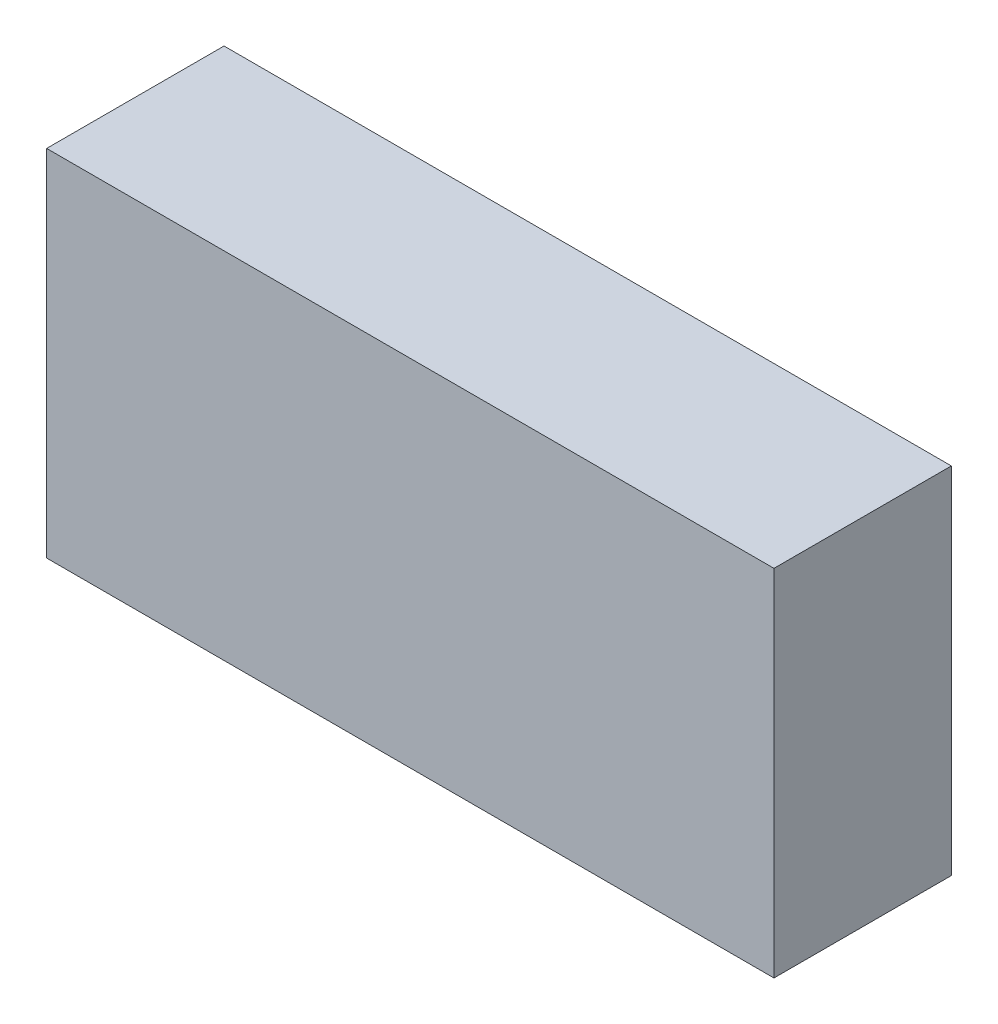
from build123d import *

# Parameters (mm, degrees)
RECTANGLESKETCH_W = 41
RECTANGLESKETCH_H = 20
BLINDBOSS_DEPTH   = 10


with BuildPart() as part:
    # RectangleSketch → BlindBoss (new body)
    with BuildSketch(Plane.XY):
        with Locations((20.5, 10)):
            Rectangle(RECTANGLESKETCH_W, RECTANGLESKETCH_H)
    extrude(amount=BLINDBOSS_DEPTH)


solid = part.part
